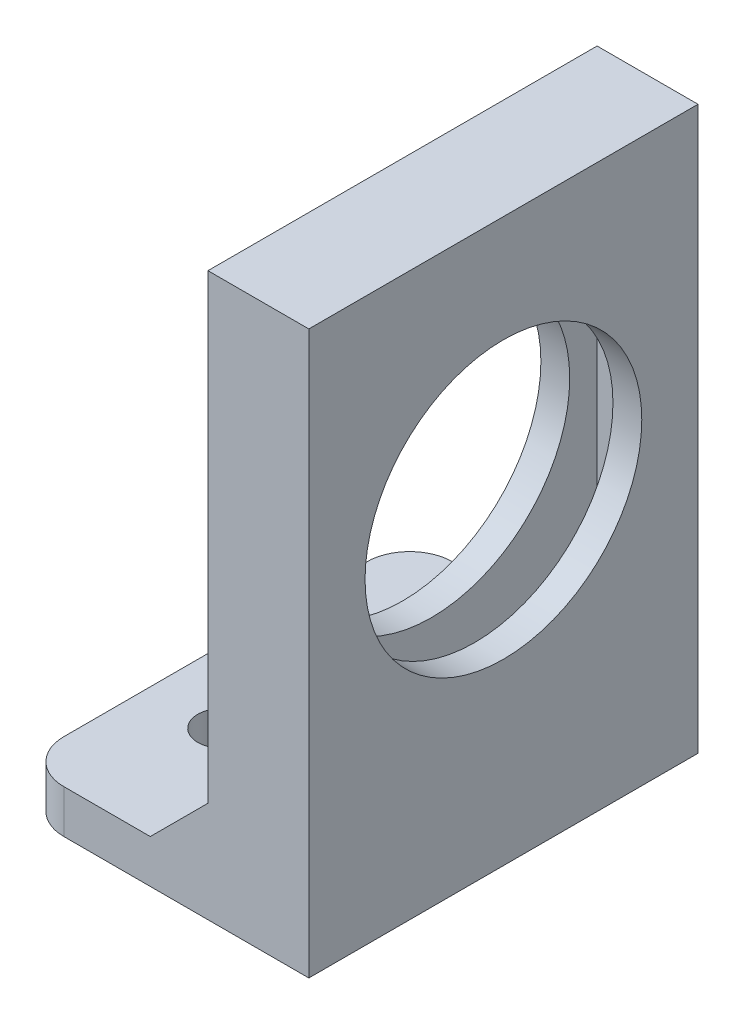
from build123d import *

# Parameters (mm, degrees)
SKETCH_1_W          = 20
SKETCH_1_H          = 27
EXTRUDE_1_DEPTH     = 3
SKETCH_2_W          = 2
SKETCH_2_H          = 27
EXTRUDE_2_DEPTH     = 34
SKETCH_3_W          = 2
SKETCH_3_H          = 27
EXTRUDE_3_DEPTH     = 34
SKETCH_4_W          = 3
SKETCH_4_H          = 2
EXTRUDE_4_DEPTH     = 34
SKETCH_6_W          = 7
SKETCH_6_H          = 27
EXTRUDE_5_DEPTH     = 2
SKETCH_7_R          = 1.7
CUT_EXTRUDE_1_DEPTH = 50.244289009
SKETCH_8_R          = 9.6
CUT_EXTRUDE_2_DEPTH = 50
CHAMFER_1_SIZE      = 4
FILLET_1_R          = 3


with BuildPart() as part:
    # 草图1 → 凸台-拉伸1 (new body)
    with BuildSketch(Plane(origin=(0, 0, 0), x_dir=(1, 0, 0), z_dir=(0, 1, 0))):
        with Locations((10, -13.5)):
            Rectangle(SKETCH_1_W, SKETCH_1_H)
    extrude(amount=EXTRUDE_1_DEPTH)

    # 草图2 → 凸台-拉伸2 (add)
    with BuildSketch(Plane(origin=(0, 3, 0), x_dir=(1, 0, 0), z_dir=(0, 1, 0))):
        with Locations((19, -13.5)):
            Rectangle(SKETCH_2_W, SKETCH_2_H)
    extrude(amount=EXTRUDE_2_DEPTH)

    # 草图3 → 凸台-拉伸3 (add)
    with BuildSketch(Plane(origin=(0, 3, 0), x_dir=(1, 0, 0), z_dir=(0, 1, 0))):
        with Locations((14, -13.5)):
            Rectangle(SKETCH_3_W, SKETCH_3_H)
    extrude(amount=EXTRUDE_3_DEPTH)

    # 草图4 → 凸台-拉伸4 (add)
    with BuildSketch(Plane(origin=(0, 3, 0), x_dir=(1, 0, 0), z_dir=(0, 1, 0))):
        with Locations((16.5, -1)):
            Rectangle(SKETCH_4_W, SKETCH_4_H)
        with Locations((16.5, -26)):
            Rectangle(SKETCH_4_W, SKETCH_4_H)
    extrude(amount=EXTRUDE_4_DEPTH)

    # 草图6 → 凸台-拉伸5 (add)
    with BuildSketch(Plane(origin=(0, 37, 0), x_dir=(1, 0, 0), z_dir=(0, 1, 0))):
        with Locations((16.5, -13.5)):
            Rectangle(SKETCH_6_W, SKETCH_6_H)
    extrude(amount=EXTRUDE_5_DEPTH)

    # 草图7 → 切除-拉伸1 (cut, through all)
    with BuildSketch(Plane(origin=(0, 3, 0), x_dir=(1, 0, 0), z_dir=(0, 1, 0))):
        with Locations(Location((5, -9, 0), (0, 0, 270))):
            Circle(SKETCH_7_R)
        with Locations(Location((5, -18, 0), (0, 0, 270))):
            Circle(SKETCH_7_R)
    extrude(amount=-CUT_EXTRUDE_1_DEPTH, mode=Mode.SUBTRACT)

    # 草图8 → 切除-拉伸2 (cut)
    with BuildSketch(Plane(origin=(20, 0, 0), x_dir=(0, 0, -1), z_dir=(1, 0, 0))):
        with Locations((-13.5, 22)):
            Circle(SKETCH_8_R)
    extrude(amount=-CUT_EXTRUDE_2_DEPTH, mode=Mode.SUBTRACT)

    # 倒角1
    chamfer_1_edges = [part.edges().sort_by_distance(p)[0] for p in [
        (13, 3, 13.5),
    ]]
    chamfer(chamfer_1_edges, length=CHAMFER_1_SIZE)

    # 圆角1
    fillet_1_edges = [part.edges().sort_by_distance(p)[0] for p in [
        (0, 1.5, 0),
        (0, 1.5, 27),
    ]]
    fillet(fillet_1_edges, radius=FILLET_1_R)


solid = part.part
